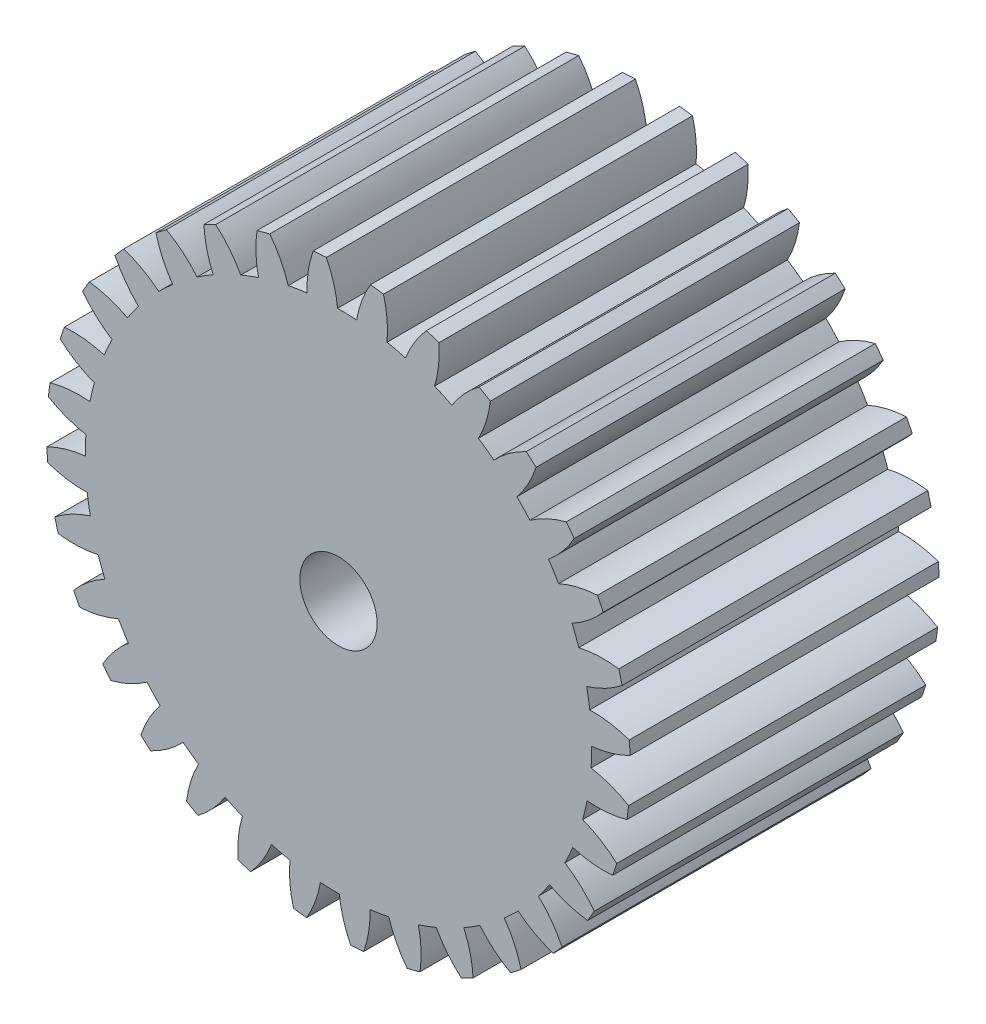
from build123d import *

# Parameters (mm, degrees)
BOSS_EXTRUDE1_DEPTH      = 3
BOSS_EXTRUDE1_DEPTH_BACK = 15
SKETCH1_R                = 2.25
CUT_EXTRUDE1_START       = -14
SKETCH3_R                = 2.25
CUT_EXTRUDE1_DEPTH       = 14


with BuildPart() as part:
    # Sketch1 → Boss-Extrude1 (new, two sides: drawn at the far end of the back side and taken through both)
    with BuildSketch(Plane.XY.offset(-BOSS_EXTRUDE1_DEPTH_BACK)):
        with BuildLine():
            ThreePointArc((14.455364376, 2.928385521), (15.537677876, 3.373010232), (16.520954781, 4.007250071))
            ThreePointArc((16.520954781, 4.007250071), (16.426570355, 4.378103057), (16.323862355, 4.746737596))
            ThreePointArc((16.323862355, 4.746737596), (15.155356917, 4.807472154), (13.995322876, 4.654453631))
            ThreePointArc((13.995322876, 4.654453631), (13.810566927, 5.176991611), (13.606308928, 5.692219105))
            ThreePointArc((13.606308928, 5.692219105), (14.5810841, 6.339449366), (15.42173356, 7.153330273))
            ThreePointArc((15.42173356, 7.153330273), (15.256812876, 7.498643934), (15.084161351, 7.840157928))
            ThreePointArc((15.084161351, 7.840157928), (13.926259693, 7.671761386), (12.818367813, 7.295371656))
            ThreePointArc((12.818367813, 7.295371656), (12.535219796, 7.771825118), (12.234370659, 8.237303902))
            ThreePointArc((12.234370659, 8.237303902), (13.064147439, 9.062267017), (13.729863768, 10.024512004))
            ThreePointArc((13.729863768, 10.024512004), (13.500744635, 10.331016131), (13.264784486, 10.632285387))
            ThreePointArc((13.264784486, 10.632285387), (12.161984119, 10.24122913), (11.148810064, 9.65593264))
            ThreePointArc((11.148810064, 9.65593264), (10.778151198, 10.067991744), (10.392272387, 10.465833729))
            ThreePointArc((10.392272387, 10.465833729), (11.045162919, 11.436826828), (11.510363011, 12.51045736))
            ThreePointArc((11.510363011, 12.51045736), (11.225850349, 12.766373171), (10.935649391, 13.015820081))
            ThreePointArc((10.935649391, 13.015820081), (9.930330315, 12.417132182), (9.050809797, 11.645421547))
            ThreePointArc((9.050809797, 11.645421547), (8.606884293, 11.977251094), (8.150804915, 12.292167435))
            ThreePointArc((8.150804915, 12.292167435), (8.601718982, 13.371875798), (8.848525458, 14.515632856))
            ThreePointArc((8.848525458, 14.515632856), (8.519552929, 14.71112565), (8.186263423, 14.899164109))
            ThreePointArc((8.186263423, 14.899164109), (7.317059487, 14.115851808), (6.604991985, 13.187383436))
            ThreePointArc((6.604991985, 13.187383436), (6.104859652, 13.426231401), (5.596106581, 13.64612004))
            ThreePointArc((5.596106581, 13.64612004), (5.827715808, 14.79305108), (5.846644034, 15.962980722))
            ThreePointArc((5.846644034, 15.962980722), (5.485853868, 16.09053782), (5.122283943, 16.209941616))
            ThreePointArc((5.122283943, 16.209941616), (4.422598166, 15.272107165), (3.905348035, 14.222561574))
            ThreePointArc((3.905348035, 14.222561574), (3.368228678, 14.359249165), (2.826353009, 14.475659904))
            ThreePointArc((2.826353009, 14.475659904), (2.829756784, 15.645737705), (2.620079359, 16.796880191))
            ThreePointArc((2.620079359, 16.796880191), (2.24133652, 16.851599645), (1.861457964, 16.897780157))
            ThreePointArc((1.861457964, 16.897780157), (1.358178878, 15.841464008), (1.05562375, 14.711174647))
            ThreePointArc((1.05562375, 14.711174647), (0.502158565, 14.740449036), (-0.052015724, 14.748908277))
            ThreePointArc((-0.052015724, 14.748908277), (-0.276948206, 15.897167404), (-0.707173496, 16.985284974))
            ThreePointArc((-0.707173496, 16.985284974), (-1.089314134, 16.965063947), (-1.470902801, 16.936246483))
            ThreePointArc((-1.470902801, 16.936246483), (-1.758434463, 15.802042274), (-1.834667563, 14.634445529))
            ThreePointArc((-1.834667563, 14.634445529), (-2.38320922, 14.555181717), (-2.928385521, 14.455364376))
            ThreePointArc((-2.928385521, 14.455364376), (-3.373010232, 15.537677876), (-4.007250071, 16.520954781))
            ThreePointArc((-4.007250071, 16.520954781), (-4.378103057, 16.426570355), (-4.746737596, 16.323862355))
            ThreePointArc((-4.746737596, 16.323862355), (-4.807472154, 15.155356917), (-4.654453631, 13.995322876))
            ThreePointArc((-4.654453631, 13.995322876), (-5.176991611, 13.810566927), (-5.692219105, 13.606308928))
            ThreePointArc((-5.692219105, 13.606308928), (-6.339449366, 14.5810841), (-7.153330273, 15.42173356))
            ThreePointArc((-7.153330273, 15.42173356), (-7.498643934, 15.256812876), (-7.840157928, 15.084161351))
            ThreePointArc((-7.840157928, 15.084161351), (-7.671761386, 13.926259693), (-7.295371656, 12.818367813))
            ThreePointArc((-7.295371656, 12.818367813), (-7.771825118, 12.535219796), (-8.237303902, 12.234370659))
            ThreePointArc((-8.237303902, 12.234370659), (-9.062267017, 13.064147439), (-10.024512004, 13.729863768))
            ThreePointArc((-10.024512004, 13.729863768), (-10.331016131, 13.500744635), (-10.632285387, 13.264784486))
            ThreePointArc((-10.632285387, 13.264784486), (-10.24122913, 12.161984119), (-9.65593264, 11.148810064))
            ThreePointArc((-9.65593264, 11.148810064), (-10.067991744, 10.778151198), (-10.465833729, 10.392272387))
            ThreePointArc((-10.465833729, 10.392272387), (-11.436826828, 11.045162919), (-12.51045736, 11.510363011))
            ThreePointArc((-12.51045736, 11.510363011), (-12.766373171, 11.225850349), (-13.015820081, 10.935649391))
            ThreePointArc((-13.015820081, 10.935649391), (-12.417132182, 9.930330315), (-11.645421547, 9.050809797))
            ThreePointArc((-11.645421547, 9.050809797), (-11.977251094, 8.606884293), (-12.292167435, 8.150804915))
            ThreePointArc((-12.292167435, 8.150804915), (-13.371875798, 8.601718982), (-14.515632856, 8.848525458))
            ThreePointArc((-14.515632856, 8.848525458), (-14.71112565, 8.519552929), (-14.899164109, 8.186263423))
            ThreePointArc((-14.899164109, 8.186263423), (-14.115851808, 7.317059487), (-13.187383436, 6.604991985))
            ThreePointArc((-13.187383436, 6.604991985), (-13.426231401, 6.104859652), (-13.64612004, 5.596106581))
            ThreePointArc((-13.64612004, 5.596106581), (-14.79305108, 5.827715808), (-15.962980722, 5.846644034))
            ThreePointArc((-15.962980722, 5.846644034), (-16.09053782, 5.485853868), (-16.209941616, 5.122283943))
            ThreePointArc((-16.209941616, 5.122283943), (-15.272107165, 4.422598166), (-14.222561574, 3.905348035))
            ThreePointArc((-14.222561574, 3.905348035), (-14.359249165, 3.368228678), (-14.475659904, 2.826353009))
            ThreePointArc((-14.475659904, 2.826353009), (-15.645737705, 2.829756784), (-16.796880191, 2.620079359))
            ThreePointArc((-16.796880191, 2.620079359), (-16.851599645, 2.24133652), (-16.897780157, 1.861457964))
            ThreePointArc((-16.897780157, 1.861457964), (-15.841464008, 1.358178878), (-14.711174647, 1.05562375))
            ThreePointArc((-14.711174647, 1.05562375), (-14.740449036, 0.502158565), (-14.748908277, -0.052015724))
            ThreePointArc((-14.748908277, -0.052015724), (-15.897167404, -0.276948206), (-16.985284974, -0.707173496))
            ThreePointArc((-16.985284974, -0.707173496), (-16.965063947, -1.089314134), (-16.936246483, -1.470902801))
            ThreePointArc((-16.936246483, -1.470902801), (-15.802042274, -1.758434463), (-14.634445529, -1.834667563))
            ThreePointArc((-14.634445529, -1.834667563), (-14.555181717, -2.38320922), (-14.455364376, -2.928385521))
            ThreePointArc((-14.455364376, -2.928385521), (-15.537677876, -3.373010232), (-16.520954781, -4.007250071))
            ThreePointArc((-16.520954781, -4.007250071), (-16.426570355, -4.378103057), (-16.323862355, -4.746737596))
            ThreePointArc((-16.323862355, -4.746737596), (-15.155356917, -4.807472154), (-13.995322876, -4.654453631))
            ThreePointArc((-13.995322876, -4.654453631), (-13.810566927, -5.176991611), (-13.606308928, -5.692219105))
            ThreePointArc((-13.606308928, -5.692219105), (-14.5810841, -6.339449366), (-15.42173356, -7.153330273))
            ThreePointArc((-15.42173356, -7.153330273), (-15.256812876, -7.498643934), (-15.084161351, -7.840157928))
            ThreePointArc((-15.084161351, -7.840157928), (-13.926259693, -7.671761386), (-12.818367813, -7.295371656))
            ThreePointArc((-12.818367813, -7.295371656), (-12.535219796, -7.771825118), (-12.234370659, -8.237303902))
            ThreePointArc((-12.234370659, -8.237303902), (-13.064147439, -9.062267017), (-13.729863768, -10.024512004))
            ThreePointArc((-13.729863768, -10.024512004), (-13.500744635, -10.331016131), (-13.264784486, -10.632285387))
            ThreePointArc((-13.264784486, -10.632285387), (-12.161984119, -10.24122913), (-11.148810064, -9.65593264))
            ThreePointArc((-11.148810064, -9.65593264), (-10.778151198, -10.067991744), (-10.392272387, -10.465833729))
            ThreePointArc((-10.392272387, -10.465833729), (-11.045162919, -11.436826828), (-11.510363011, -12.51045736))
            ThreePointArc((-11.510363011, -12.51045736), (-11.225850349, -12.766373171), (-10.935649391, -13.015820081))
            ThreePointArc((-10.935649391, -13.015820081), (-9.930330315, -12.417132182), (-9.050809797, -11.645421547))
            ThreePointArc((-9.050809797, -11.645421547), (-8.606884293, -11.977251094), (-8.150804915, -12.292167435))
            ThreePointArc((-8.150804915, -12.292167435), (-8.601718982, -13.371875798), (-8.848525458, -14.515632856))
            ThreePointArc((-8.848525458, -14.515632856), (-8.519552929, -14.71112565), (-8.186263423, -14.899164109))
            ThreePointArc((-8.186263423, -14.899164109), (-7.317059487, -14.115851808), (-6.604991985, -13.187383436))
            ThreePointArc((-6.604991985, -13.187383436), (-6.104859652, -13.426231401), (-5.596106581, -13.64612004))
            ThreePointArc((-5.596106581, -13.64612004), (-5.827715808, -14.79305108), (-5.846644034, -15.962980722))
            ThreePointArc((-5.846644034, -15.962980722), (-5.485853868, -16.09053782), (-5.122283943, -16.209941616))
            ThreePointArc((-5.122283943, -16.209941616), (-4.422598166, -15.272107165), (-3.905348035, -14.222561574))
            ThreePointArc((-3.905348035, -14.222561574), (-3.368228678, -14.359249165), (-2.826353009, -14.475659904))
            ThreePointArc((-2.826353009, -14.475659904), (-2.829756784, -15.645737705), (-2.620079359, -16.796880191))
            ThreePointArc((-2.620079359, -16.796880191), (-2.24133652, -16.851599645), (-1.861457964, -16.897780157))
            ThreePointArc((-1.861457964, -16.897780157), (-1.358178878, -15.841464008), (-1.05562375, -14.711174647))
            ThreePointArc((-1.05562375, -14.711174647), (-0.502158565, -14.740449036), (0.052015724, -14.748908277))
            ThreePointArc((0.052015724, -14.748908277), (0.276948206, -15.897167404), (0.707173496, -16.985284974))
            ThreePointArc((0.707173496, -16.985284974), (1.089314134, -16.965063947), (1.470902801, -16.936246483))
            ThreePointArc((1.470902801, -16.936246483), (1.758434463, -15.802042274), (1.834667563, -14.634445529))
            ThreePointArc((1.834667563, -14.634445529), (2.38320922, -14.555181717), (2.928385521, -14.455364376))
            ThreePointArc((2.928385521, -14.455364376), (3.373010232, -15.537677876), (4.007250071, -16.520954781))
            ThreePointArc((4.007250071, -16.520954781), (4.378103057, -16.426570355), (4.746737596, -16.323862355))
            ThreePointArc((4.746737596, -16.323862355), (4.807472154, -15.155356917), (4.654453631, -13.995322876))
            ThreePointArc((4.654453631, -13.995322876), (5.176991611, -13.810566927), (5.692219105, -13.606308928))
            ThreePointArc((5.692219105, -13.606308928), (6.339449366, -14.5810841), (7.153330273, -15.42173356))
            ThreePointArc((7.153330273, -15.42173356), (7.498643934, -15.256812876), (7.840157928, -15.084161351))
            ThreePointArc((7.840157928, -15.084161351), (7.671761386, -13.926259693), (7.295371656, -12.818367813))
            ThreePointArc((7.295371656, -12.818367813), (7.771825118, -12.535219796), (8.237303902, -12.234370659))
            ThreePointArc((8.237303902, -12.234370659), (9.062267017, -13.064147439), (10.024512004, -13.729863768))
            ThreePointArc((10.024512004, -13.729863768), (10.331016131, -13.500744635), (10.632285387, -13.264784486))
            ThreePointArc((10.632285387, -13.264784486), (10.24122913, -12.161984119), (9.65593264, -11.148810064))
            ThreePointArc((9.65593264, -11.148810064), (10.067991744, -10.778151198), (10.465833729, -10.392272387))
            ThreePointArc((10.465833729, -10.392272387), (11.436826828, -11.045162919), (12.51045736, -11.510363011))
            ThreePointArc((12.51045736, -11.510363011), (12.766373171, -11.225850349), (13.015820081, -10.935649391))
            ThreePointArc((13.015820081, -10.935649391), (12.417132182, -9.930330315), (11.645421547, -9.050809797))
            ThreePointArc((11.645421547, -9.050809797), (11.977251094, -8.606884293), (12.292167435, -8.150804915))
            ThreePointArc((12.292167435, -8.150804915), (13.371875798, -8.601718982), (14.515632856, -8.848525458))
            ThreePointArc((14.515632856, -8.848525458), (14.71112565, -8.519552929), (14.899164109, -8.186263423))
            ThreePointArc((14.899164109, -8.186263423), (14.115851808, -7.317059487), (13.187383436, -6.604991985))
            ThreePointArc((13.187383436, -6.604991985), (13.426231401, -6.104859652), (13.64612004, -5.596106581))
            ThreePointArc((13.64612004, -5.596106581), (14.79305108, -5.827715808), (15.962980722, -5.846644034))
            ThreePointArc((15.962980722, -5.846644034), (16.09053782, -5.485853868), (16.209941616, -5.122283943))
            ThreePointArc((16.209941616, -5.122283943), (15.272107165, -4.422598166), (14.222561574, -3.905348035))
            ThreePointArc((14.222561574, -3.905348035), (14.359249165, -3.368228678), (14.475659904, -2.826353009))
            ThreePointArc((14.475659904, -2.826353009), (15.645737705, -2.829756784), (16.796880191, -2.620079359))
            ThreePointArc((16.796880191, -2.620079359), (16.851599645, -2.24133652), (16.897780157, -1.861457964))
            ThreePointArc((16.897780157, -1.861457964), (15.841464008, -1.358178878), (14.711174647, -1.05562375))
            ThreePointArc((14.711174647, -1.05562375), (14.740449036, -0.502158565), (14.748908277, 0.052015724))
            ThreePointArc((14.748908277, 0.052015724), (15.897167404, 0.276948206), (16.985284974, 0.707173496))
            ThreePointArc((16.985284974, 0.707173496), (16.965063947, 1.089314134), (16.936246483, 1.470902801))
            ThreePointArc((16.936246483, 1.470902801), (15.802042274, 1.758434463), (14.634445529, 1.834667563))
            ThreePointArc((14.634445529, 1.834667563), (14.555181717, 2.38320922), (14.455364376, 2.928385521))
        make_face()
        Circle(SKETCH1_R, mode=Mode.SUBTRACT)
    extrude(amount=BOSS_EXTRUDE1_DEPTH + BOSS_EXTRUDE1_DEPTH_BACK)

    # Sketch3 → Cut-Extrude1 (cut)
    with BuildSketch(Plane.XY.offset(-1).offset(CUT_EXTRUDE1_START)):
        Polygon((-3.464101615, -6), (3.464101615, -6), (6.92820323, 0), (3.464101615, 6), (-3.464101615, 6), (-6.92820323, 0), align=None)
        Circle(SKETCH3_R, mode=Mode.SUBTRACT)
    extrude(amount=CUT_EXTRUDE1_DEPTH, mode=Mode.SUBTRACT)


solid = part.part
